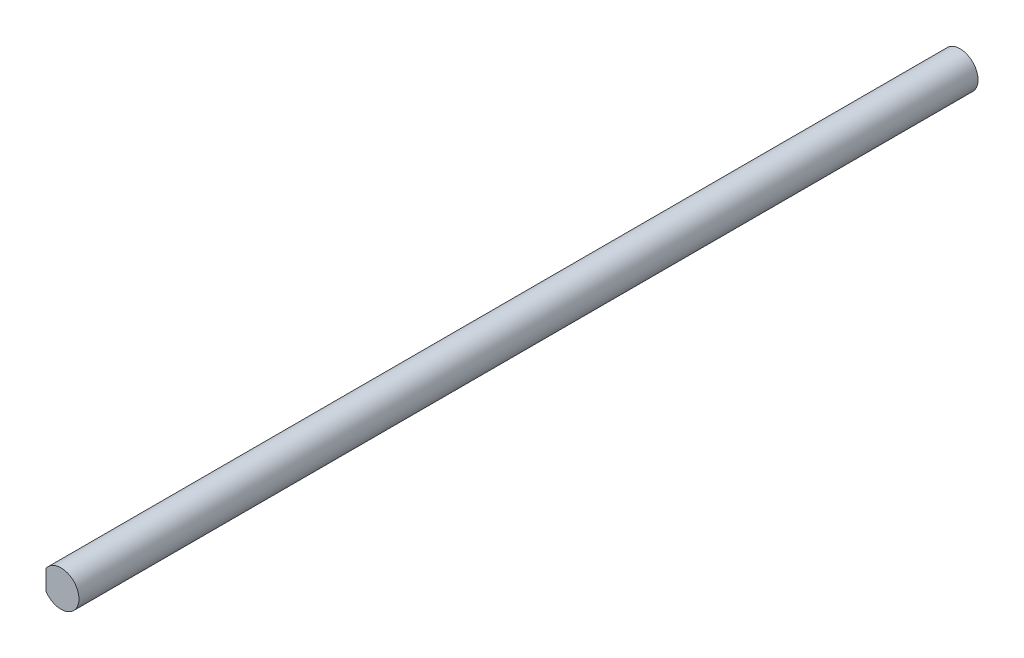
from build123d import *

# Parameters (mm, degrees)
BOSS_EXTRUDE1_DEPTH = 150


with BuildPart() as part:
    # Sketch1 → Boss-Extrude1 (new body)
    with BuildSketch(Plane.XY):
        with BuildLine():
            Line((-2.5, 1.658312395), (-2.5, -1.658312395))
            ThreePointArc((-2.5, -1.658312395), (3, 0), (-2.5, 1.658312395))
        make_face()
    extrude(amount=BOSS_EXTRUDE1_DEPTH)


solid = part.part
